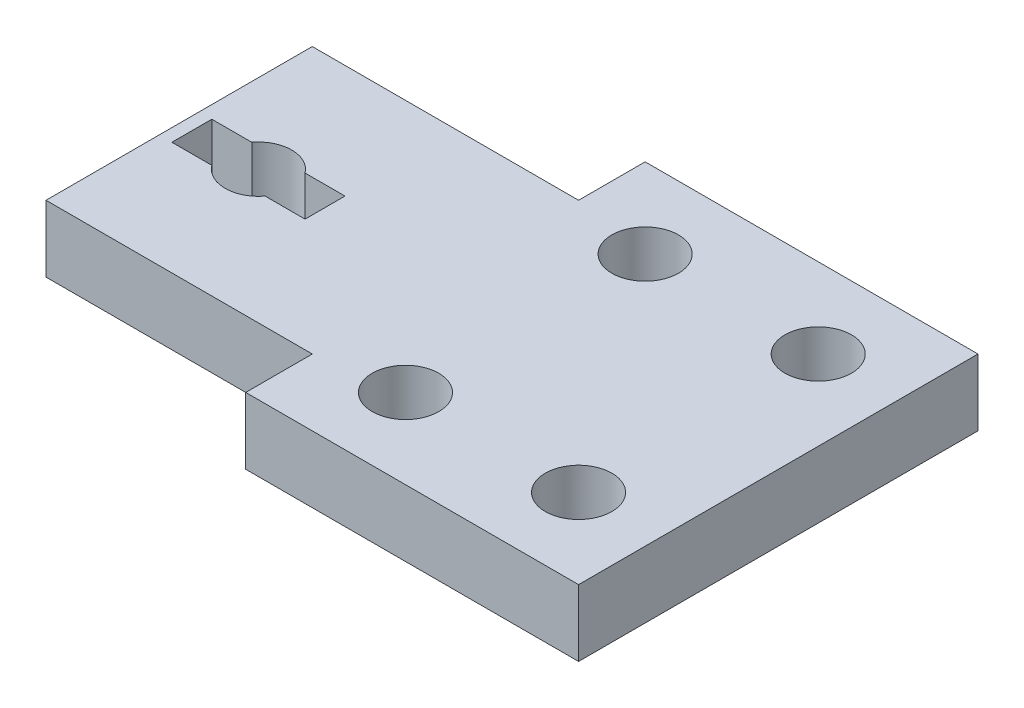
from build123d import *

# Parameters (mm, degrees)
SKETCH1_W               = 25
SKETCH1_H               = 5
BOSS_EXTRUDE2_DEPTH     = 30
CUT_EXTRUDE1_DEPTH      = 40.37003937
CUT_EXTRUDE1_DEPTH_BACK = 40.37003937
SKETCH2_R               = 2.5
SKETCH5_W               = 20
SKETCH5_H               = 5
BOSS_EXTRUDE3_DEPTH     = 20
CUT_EXTRUDE3_DEPTH      = 40.37003937


with BuildPart() as part:
    # Sketch1 → Boss-Extrude2 (new body)
    with BuildSketch(Plane.XY):
        with Locations((12.5, 2.5)):
            Rectangle(SKETCH1_W, SKETCH1_H)
    extrude(amount=BOSS_EXTRUDE2_DEPTH)

    # Sketch2 → Cut-Extrude1 (cut, two sides: drawn at the far end of the back side and taken through both)
    with BuildSketch(Plane(origin=(0, 5, 0), x_dir=(1, 0, 0), z_dir=(0, 1, 0)).offset(-CUT_EXTRUDE1_DEPTH_BACK)):
        with Locations(Location((6, -6, 0), (0, 0, 180))):
            Circle(SKETCH2_R)
        with Locations(Location((19, -6, 0), (0, 0, 180))):
            Circle(SKETCH2_R)
        with Locations(Location((19, -24, 0), (0, 0, 180))):
            Circle(SKETCH2_R)
        with Locations(Location((6, -24, 0), (0, 0, 180))):
            Circle(SKETCH2_R)
    extrude(amount=CUT_EXTRUDE1_DEPTH + CUT_EXTRUDE1_DEPTH_BACK, mode=Mode.SUBTRACT)

    # Sketch5 → Boss-Extrude3 (add)
    with BuildSketch(Plane.ZY):
        with Locations((15, 2.5)):
            Rectangle(SKETCH5_W, SKETCH5_H)
    extrude(amount=BOSS_EXTRUDE3_DEPTH)

    # Sketch6 → Cut-Extrude3 (cut, through all)
    with BuildSketch(Plane(origin=(0, 5, 0), x_dir=(1, 0, 0), z_dir=(0, 1, 0))):
        with BuildLine():
            Line((-12.044559796, -13.5), (-9.044559796, -13.5))
            Line((-9.044559796, -13.5), (-9.044559796, -16.5))
            Line((-9.044559796, -16.5), (-12.044559796, -16.5))
            ThreePointArc((-12.044559796, -16.5), (-14.044559796, -17.5), (-16.044559796, -16.5))
            Line((-16.044559796, -16.5), (-19.044559796, -16.5))
            Line((-19.044559796, -16.5), (-19.044559796, -13.5))
            Line((-19.044559796, -13.5), (-16.044559796, -13.5))
            ThreePointArc((-16.044559796, -13.5), (-14.044559796, -12.5), (-12.044559796, -13.5))
        make_face()
    extrude(amount=-CUT_EXTRUDE3_DEPTH, mode=Mode.SUBTRACT)


solid = part.part
